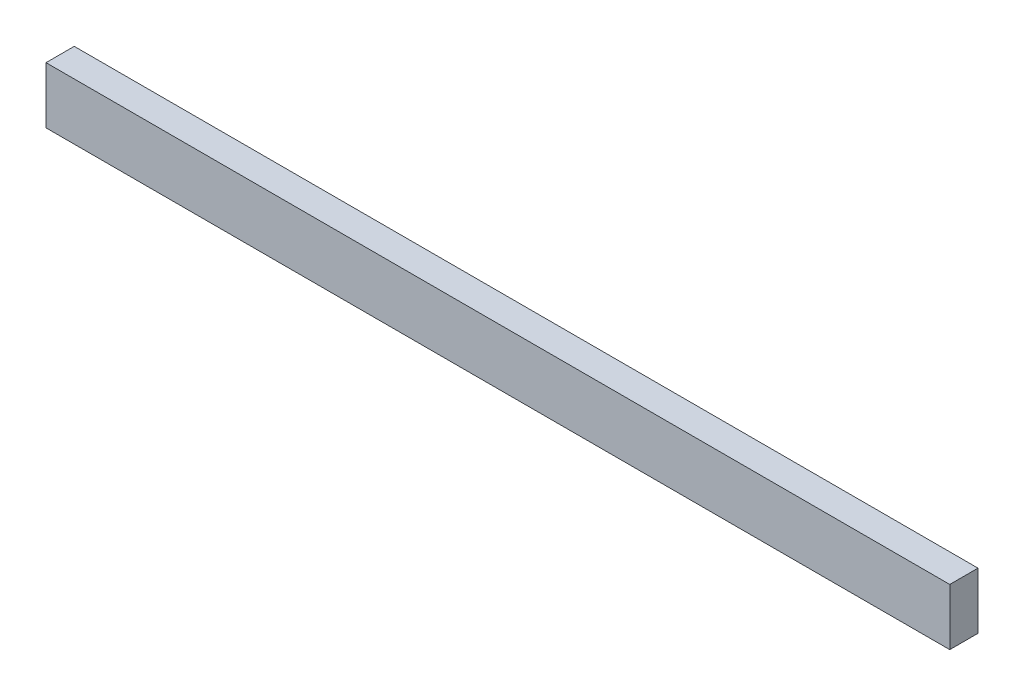
from build123d import *

# Parameters (mm, degrees)
SKETCH1_W      = 1219.2
SKETCH1_H      = 38.1
EXTRUDE1_DEPTH = 76.2


with BuildPart() as part:
    # Sketch1 → Extrude1 (new body)
    with BuildSketch(Plane(origin=(0, 0, 0), x_dir=(1, 0, 0), z_dir=(0, 1, 0))):
        with Locations((609.6, 19.05)):
            Rectangle(SKETCH1_W, SKETCH1_H)
    extrude(amount=EXTRUDE1_DEPTH)


solid = part.part
